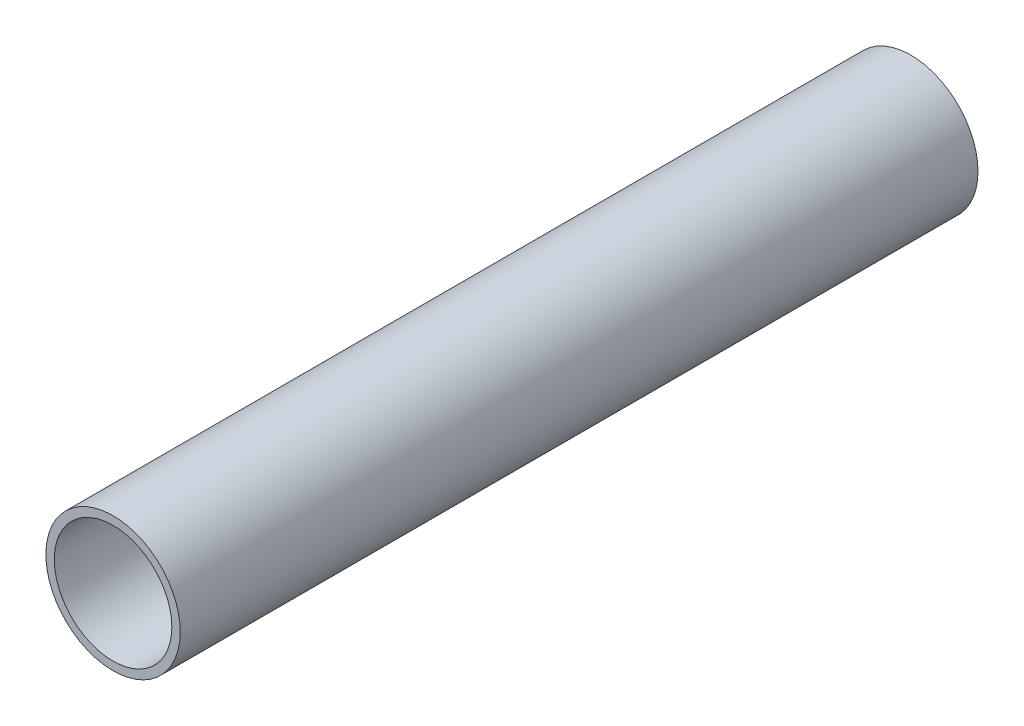
from build123d import *

# Parameters (mm, degrees)
SKETCH1_R           = 8
SKETCH1_R_2         = 7
BOSS_EXTRUDE1_DEPTH = 95


with BuildPart() as part:
    # Sketch1 → Boss-Extrude1 (new body)
    with BuildSketch(Plane.XY):
        Circle(SKETCH1_R)
        Circle(SKETCH1_R_2, mode=Mode.SUBTRACT)
    extrude(amount=BOSS_EXTRUDE1_DEPTH)


solid = part.part
